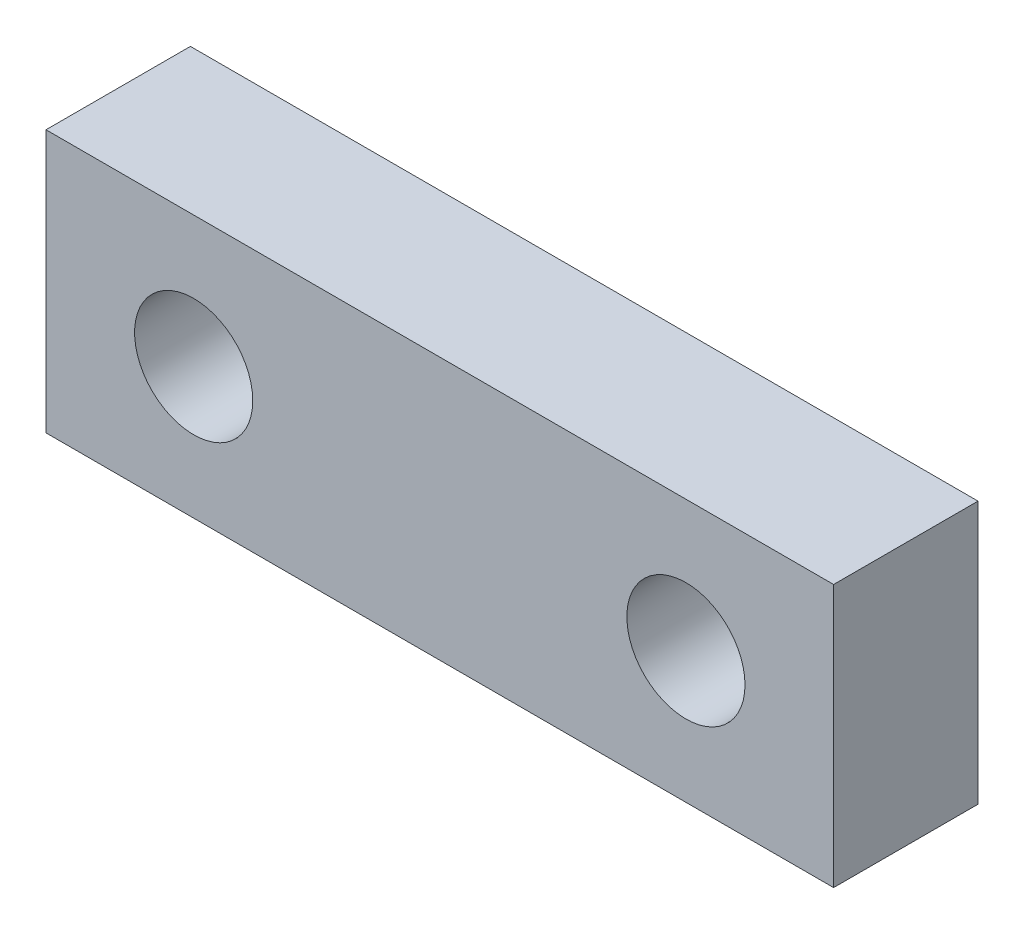
from build123d import *

# Parameters (mm, degrees)
SKETCH1_W           = 30
SKETCH1_H           = 10
SKETCH1_R           = 3.5
BOSS_EXTRUDE1_DEPTH = 1.5
SKETCH2_W           = 30
SKETCH2_H           = 10
SKETCH2_R           = 2.25
BOSS_EXTRUDE2_DEPTH = 4


with BuildPart() as part:
    # Sketch1 → Boss-Extrude1 (new body)
    with BuildSketch(Plane.XY):
        Rectangle(SKETCH1_W, SKETCH1_H)
        with Locations((-9.375, 0)):
            Circle(SKETCH1_R, mode=Mode.SUBTRACT)
        with Locations((9.375, 0)):
            Circle(SKETCH1_R, mode=Mode.SUBTRACT)
    extrude(amount=BOSS_EXTRUDE1_DEPTH)

    # Sketch2 → Boss-Extrude2 (add)
    with BuildSketch(Plane.XY.offset(1.5)):
        Rectangle(SKETCH2_W, SKETCH2_H)
        with Locations((-9.375, 0)):
            Circle(SKETCH2_R, mode=Mode.SUBTRACT)
        with Locations((9.375, 0)):
            Circle(SKETCH2_R, mode=Mode.SUBTRACT)
    extrude(amount=BOSS_EXTRUDE2_DEPTH)


solid = part.part
